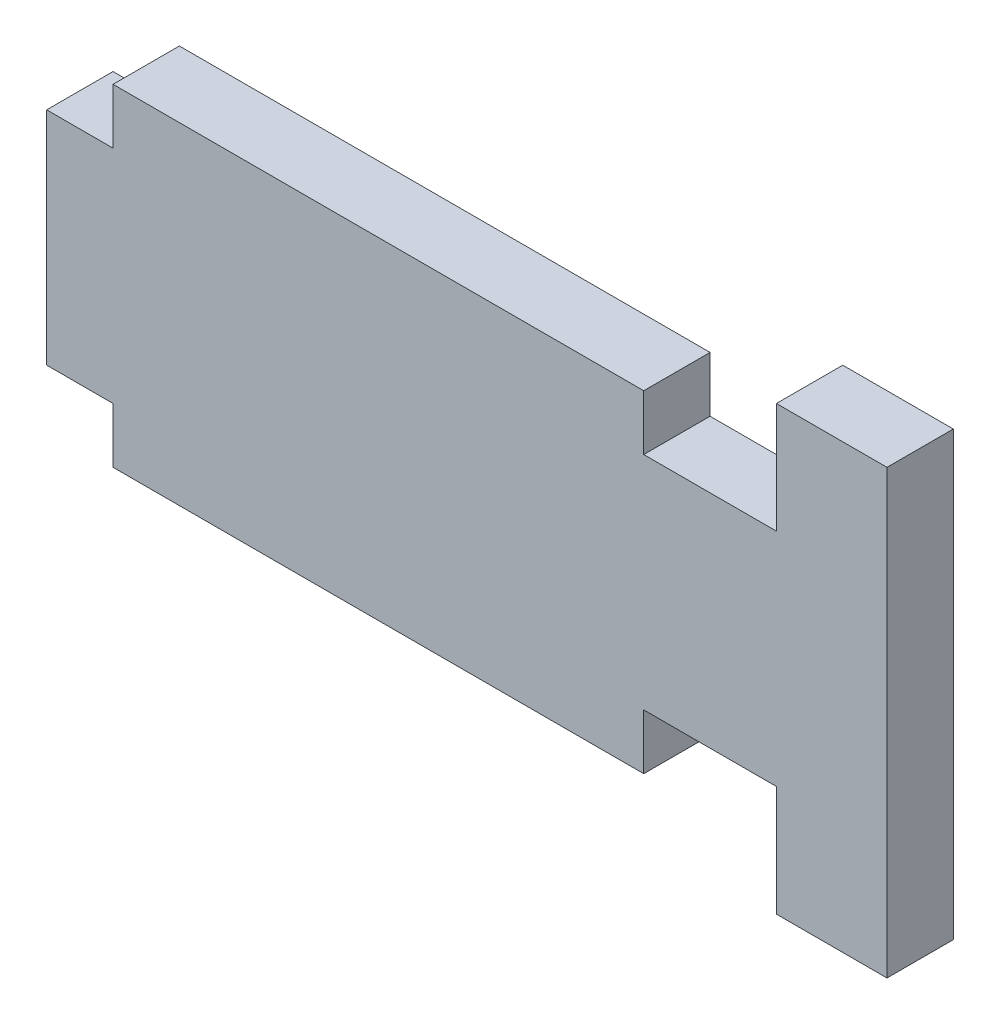
from build123d import *

# Parameters (mm, degrees)
ESBO_O1_W                = 3
ESBO_O1_H                = 10
ESBO_O1_W_2              = 6
RESSALTO_EXTRUS_O1_DEPTH = 3


with BuildPart() as part:
    # Esboço1 → Ressalto-extrusão1 (new body)
    with BuildSketch(Plane.XY):
        Polygon((-12, -5), (-12, -7.5), (12, -7.5), (12, -5), (12, 5), (12, 7.5), (-12, 7.5), (-12, 5), align=None)
        with Locations((-13.5, 0)):
            Rectangle(ESBO_O1_W, ESBO_O1_H)
        with Locations((15, 0)):
            Rectangle(ESBO_O1_W_2, ESBO_O1_H)
        Polygon((18, 5), (18, -5), (18, -10), (23, -10), (23, 10), (18, 10), align=None)
    extrude(amount=RESSALTO_EXTRUS_O1_DEPTH)


solid = part.part
